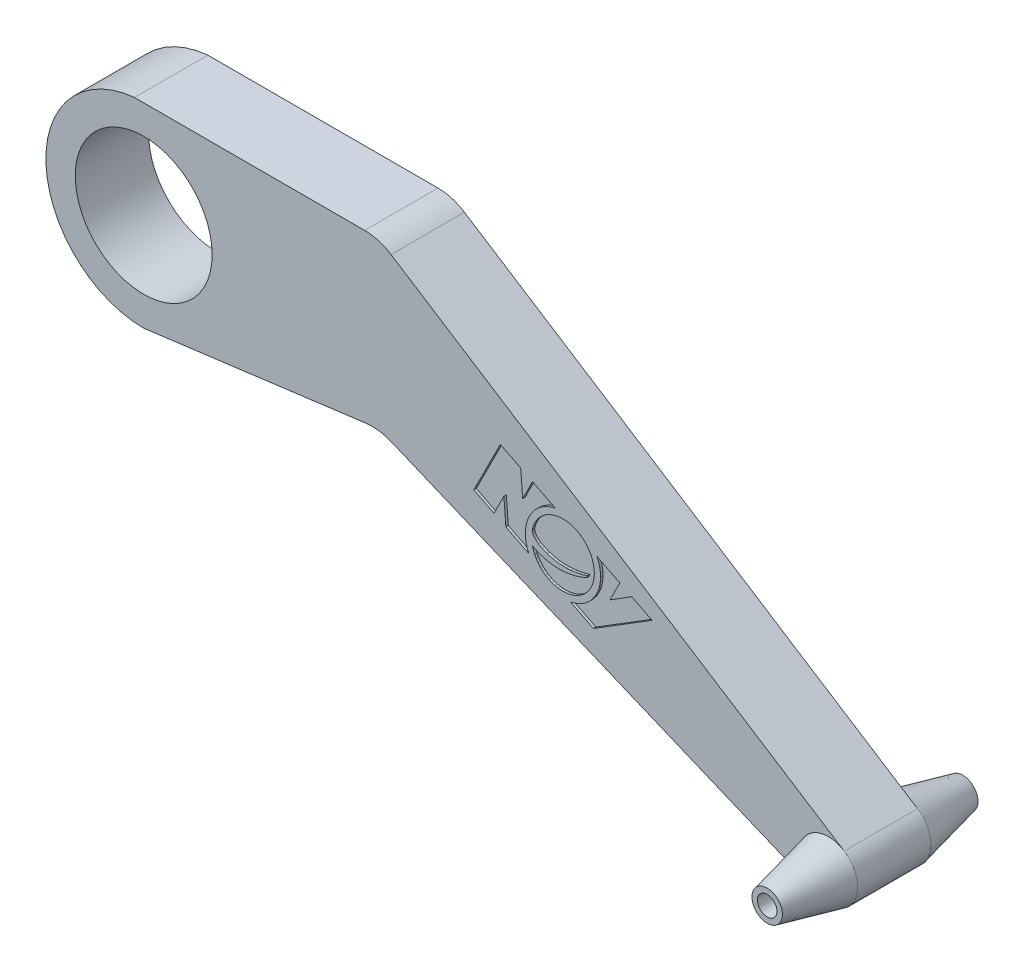
from build123d import *

# Parameters (mm, degrees)
SKETCH1_R           = 14
SKETCH1_R_2         = 2
BOSS_EXTRUDE1_DEPTH = 7.5
SKETCH5_R           = 6
BOSS_EXTRUDE3_DEPTH = 12.5
BOSS_EXTRUDE3_TAPER = 13
SKETCH6_R           = 2
CUT_EXTRUDE3_DEPTH  = 12.5
CUT_EXTRUDE4_DEPTH  = 0.5
CUT_EXTRUDE9_START  = 1
CUT_EXTRUDE9_DEPTH  = 0.5


with BuildPart() as part:
    # Sketch1 → Boss-Extrude1 (new, symmetric)
    with BuildSketch(Plane.XY):
        with BuildLine():
            Line((-1.888942845, 19.910597553), (45.184817507, 19.910597553))
            ThreePointArc((45.184817507, 19.910597553), (47.993283797, 19.508124167), (50.5756835, 18.333100972))
            Line((50.5756835, 18.333100972), (143.234519596, -40.973656604))
            ThreePointArc((143.234519596, -40.973656604), (145.758515968, -47.712238429), (140, -52.027158655))
            Line((140, -52.027158655), (50.584622054, -14.789702185))
            ThreePointArc((50.584622054, -14.789702185), (48.06434407, -14.109230095), (45.453823338, -14.104240905))
            Line((45.453823338, -14.104240905), (0, -20))
            ThreePointArc((0, -20), (-19.977636886, -0.945528671), (-1.888942845, 19.910597553))
        make_face()
        Circle(SKETCH1_R, mode=Mode.SUBTRACT)
        with Locations((140, -46.027158655)):
            Circle(SKETCH1_R_2, mode=Mode.SUBTRACT)
    extrude(amount=BOSS_EXTRUDE1_DEPTH, both=True)

    # Sketch8 → Cut-Extrude4 (cut)
    with BuildSketch(Plane(origin=(0, 0, -7.5), x_dir=(-1, 0, 0), z_dir=(0, 0, -1))):
        Polygon((-79.550957141, -14.224301957), (-79.282825395, -14.823470434), (-79.080376233, -15.434856393), (-78.942199909, -16.054123411), (-78.866887024, -16.67693496), (-78.853028165, -17.298955645), (-78.899213932, -17.915848934), (-79.004034807, -18.523278523), (-79.166081268, -19.116908677), (-79.383943798, -19.69240309), (-79.65621288, -20.245425459), (-79.981478992, -20.771640047), (-80.358332733, -21.266710323), (-80.785364923, -21.726300441), (-81.261165702, -22.146074206), (-81.784325554, -22.521695315), (-82.353435187, -22.848827578), (-83.024949211, -23.144512231), (-83.711101375, -23.358107219), (-84.405810605, -23.491598034), (-85.102994918, -23.546970273), (-85.796573018, -23.526208746), (-86.480463032, -23.431299394), (-87.148583776, -23.264227365), (-87.794853492, -23.026978374), (-87.129885082, -22.730738515), (-86.372816391, -22.275402676), (-85.520439303, -21.635556199), (-84.569546045, -20.785784314), (-83.872474036, -20.040892853), (-83.254772444, -19.236090568), (-82.714902997, -18.388116691), (-82.25132708, -17.513710566), (-81.862506422, -16.629611425), (-81.546902866, -15.752558274), (-81.302977572, -14.89929034), (-81.129192383, -14.086546629), (-81.365529924, -13.776215138), (-81.635406182, -14.544166728), (-81.967040942, -15.337343935), (-82.357753829, -16.140226416), (-82.804864802, -16.937294284), (-83.305693827, -17.713027083), (-83.857560527, -18.45190447), (-84.457784972, -19.1384069), (-85.103686902, -19.757013802), (-86.122428638, -20.564345175), (-87.013602766, -21.128480092), (-87.782181086, -21.486445387), (-88.433134714, -21.675267546), (-88.971435108, -21.73197351), (-89.402054179, -21.693589887), (-89.72996259, -21.5971435), (-89.96013248, -21.479661069), (-90.022446472, -21.434930826), (-90.540673299, -20.7802485), (-90.97825817, -20.04680265), (-91.246430112, -19.447561435), (-91.448919155, -18.836114552), (-91.587133692, -18.216796591), (-91.662482681, -17.593942718), (-91.67637395, -16.97188752), (-91.630216454, -16.35496616), (-91.525418363, -15.747513116), (-91.363388182, -15.15386332), (-91.145534757, -14.578351596), (-90.873266137, -14.025313213), (-90.547991174, -13.499082428), (-90.171117915, -13.00399451), (-89.744055096, -12.54438394), (-89.268211223, -12.124585651), (-88.744994686, -11.748934805), (-88.175813878, -11.421765991), (-87.576643953, -11.153630372), (-86.965254101, -10.951170389), (-86.345980273, -10.812978338), (-85.723158874, -10.73764618), (-85.101126422, -10.723766217), (-84.484218526, -10.769930857), (-83.876771707, -10.874731835), (-83.283121685, -11.036761901), (-82.707604982, -11.254612789), (-82.154557774, -11.526876912), (-81.628316125, -11.85214634), (-81.133216212, -12.229013487), (-80.673594326, -12.65607054), (-80.253786306, -13.131909455), (-79.878128444, -13.655122418), align=None)
        Polygon((-76.671472779, -6.000191339), (-77.051444375, -11.22878599), (-79.088140392, -7.23154499), (-83.730041768, -9.596711875), (-82.910288344, -9.81143241), (-82.118949812, -10.114289661), (-81.363894744, -10.502779851), (-80.652992399, -10.974398415), (-79.994110781, -11.526641571), (-79.395119256, -12.157005663), (-78.863886515, -12.862986119), (-78.408280788, -13.642079274), (-78.045822298, -14.468526986), (-77.78695889, -15.313193616), (-77.629090119, -16.168240302), (-77.569615999, -17.025827846), (-77.605936088, -17.878116816), (-77.735449715, -18.717268237), (-77.955556552, -19.535443019), (-78.263656273, -20.324801507), (-73.603910814, -17.950542607), (-72.510102686, -3.879867371), align=None)
        Polygon((-86.799147435, -24.673851478), (-91.476197895, -27.056927715), (-95.92974122, -24.291131927), (-93.893045203, -28.288372926), (-98.009685591, -30.38590597), (-103.475951364, -19.657755338), (-99.324281613, -17.542373942), (-94.87067854, -20.308139288), (-96.907374557, -16.310898288), (-92.265293487, -13.945639844), (-92.573422388, -14.735045128), (-92.793549633, -15.553269933), (-92.923074432, -16.392476078), (-92.959396003, -17.244824243), (-92.899913666, -18.102476587), (-92.742026294, -18.957594471), (-92.483133893, -19.802339261), (-92.120634881, -20.628872657), (-91.665059176, -21.407871642), (-91.133865442, -22.113771628), (-90.534918955, -22.744068586), (-89.876083639, -23.296257795), (-89.165224431, -23.767835337), (-88.410205594, -24.156296382), (-87.618891729, -24.459136553), align=None)
    extrude(amount=-CUT_EXTRUDE4_DEPTH, mode=Mode.SUBTRACT)

    # Sketch15 → Cut-Extrude9 (cut)
    with BuildSketch(Plane(origin=(0, 0, 8.5), x_dir=(-1, 0, 0), z_dir=(0, 0, -1)).offset(CUT_EXTRUDE9_START)):
        Polygon((-78.436545805, -19.744587908), (-78.748402928, -20.532514517), (-74.060129375, -18.171594261), (-73.655242986, -12.944765251), (-71.637482578, -16.951598067), (-67.510963863, -14.873566248), (-72.926408564, -4.119672247), (-77.0880407, -6.215386478), (-77.49298698, -11.442245648), (-79.510747387, -7.435412832), (-84.163967638, -9.778680949), (-83.345236837, -9.99727646), (-82.555333316, -10.303871085), (-81.802115073, -10.695924533), (-81.093441017, -11.17089583), (-80.437168805, -11.726244798), (-79.841157003, -12.359431143), (-79.313263499, -13.067913666), (-78.861346857, -13.849152641), (-78.502818509, -14.677310878), (-78.247960656, -15.523188558), (-78.094138964, -16.378963081), (-78.038720458, -17.236812535), (-78.079070916, -18.088914661), (-78.21255725, -18.927447204), align=None)
        Polygon((-103.966563176, -19.750869727), (-99.795207421, -17.650258877), (-95.354980343, -20.437186206), (-97.37274075, -16.43035339), (-92.719700626, -14.087175981), (-93.031558627, -14.87511327), (-93.255548005, -15.692283965), (-93.389032275, -16.530862961), (-93.42937518, -17.383024134), (-93.373940573, -18.240942833), (-93.220091402, -19.096793385), (-92.965191748, -19.942750119), (-92.60660524, -20.770988273), (-92.154733705, -21.552143887), (-91.626886064, -22.260556794), (-91.030920658, -22.893686022), (-90.374695829, -23.448990028), (-89.666070373, -23.923927501), (-88.91290286, -24.315957579), (-88.123051743, -24.622539064), (-87.304375933, -24.841130416), (-91.97530296, -27.19331531), align=None)
        Polygon((-91.726518066, -19.593674032), (-91.46118691, -20.194178643), (-91.13674968, -20.764825628), (-90.763604146, -21.289745492), (-90.346080459, -21.767509353), (-89.888508658, -22.196687991), (-89.39521787, -22.575852861), (-88.870538135, -22.903574741), (-88.318799377, -23.178424637), (-87.744331066, -23.398973892), (-87.151463126, -23.563793511), (-86.54452548, -23.6714545), (-85.9278476, -23.720528201), (-85.305759523, -23.709585394), (-84.682590606, -23.637197082), (-84.062670886, -23.501934609), (-83.450330288, -23.302368982), (-82.849898509, -23.03707109), (-82.214237534, -22.670607418), (-81.636099432, -22.243777304), (-81.11748105, -21.762658102), (-80.660379685, -21.233327966), (-80.266792867, -20.661864023), (-79.938717551, -20.054344538), (-79.678150926, -19.416846754), (-79.487090061, -18.755448707), (-80.119326231, -19.116306667), (-80.934316977, -19.457296128), (-81.954450223, -19.765968083), (-83.202113777, -20.029873183), (-84.215057613, -20.151188717), (-85.229347109, -20.173070057), (-86.232396698, -20.106660437), (-87.211620926, -19.963103433), (-88.154434226, -19.753542281), (-89.048251146, -19.489119989), (-89.880486458, -19.180980246), (-90.638554711, -18.840266062), (-90.748933465, -18.46613026), (-89.970129721, -18.702873934), (-89.134451674, -18.904749884), (-88.255997972, -19.064737166), (-87.348866691, -19.175814832), (-86.427156366, -19.230961598), (-85.504965644, -19.223156518), (-84.596392262, -19.145378759), (-83.71553498, -18.99060715), (-82.461948506, -18.646892702), (-81.479903371, -18.262150079), (-80.736606201, -17.854276198), (-80.199264303, -17.441168322), (-79.835084414, -17.040723708), (-79.611273275, -16.670839048), (-79.495038192, -16.349412171), (-79.453585678, -16.094339654), (-79.452783037, -16.017637738), (-79.674019143, -15.212515028), (-80.006464825, -14.425811016), (-80.330936916, -13.855088591), (-80.704107977, -13.330100531), (-81.121650127, -12.852275723), (-81.579234692, -12.423042938), (-82.072534132, -12.04383152), (-82.597219773, -11.71607024), (-83.148963962, -11.441188099), (-83.723438478, -11.220614099), (-84.316314988, -11.055776897), (-84.92326527, -10.948106062), (-85.539961446, -10.899029914), (-86.162075293, -10.90997802), (-86.78527882, -10.982378927), (-87.405243806, -11.117661634), (-88.017641915, -11.31725537), (-88.618145268, -11.582589021), (-89.188796233, -11.907025126), (-89.713727124, -12.280167398), (-90.191507695, -12.697687271), (-90.620707698, -13.155255612), (-90.999896544, -13.648543401), (-91.327644099, -14.173222414), (-91.602520228, -14.724963292), (-91.823094456, -15.299437922), (-91.987936648, -15.892316946), (-92.095616331, -16.499271683), (-92.144703368, -17.115973343), (-92.133767286, -17.738093245), (-92.061377722, -18.361302484), (-91.926104769, -18.981272382), align=None)
    extrude(amount=CUT_EXTRUDE9_DEPTH, mode=Mode.SUBTRACT)


with BuildPart() as body_2:
    # Sketch5 → Boss-Extrude3 (new body)
    with BuildSketch(Plane(origin=(0, 0, -7.5), x_dir=(-1, 0, 0), z_dir=(0, 0, -1))):
        with Locations((-140, -46.027158655)):
            Circle(SKETCH5_R)
    extrude(amount=BOSS_EXTRUDE3_DEPTH, taper=BOSS_EXTRUDE3_TAPER)

    # Sketch6 → Cut-Extrude3 (cut)
    with BuildSketch(Plane(origin=(0, 0, -20), x_dir=(-1, 0, 0), z_dir=(0, 0, -1))):
        with Locations((-140, -46.027158655)):
            Circle(SKETCH6_R)
    extrude(amount=-CUT_EXTRUDE3_DEPTH, mode=Mode.SUBTRACT)


with BuildPart() as body_3:
    # Mirror4: mirrored copy
    add(body_2.part.mirror(Plane.XY))


solid = Compound([part.part, body_2.part, body_3.part])
